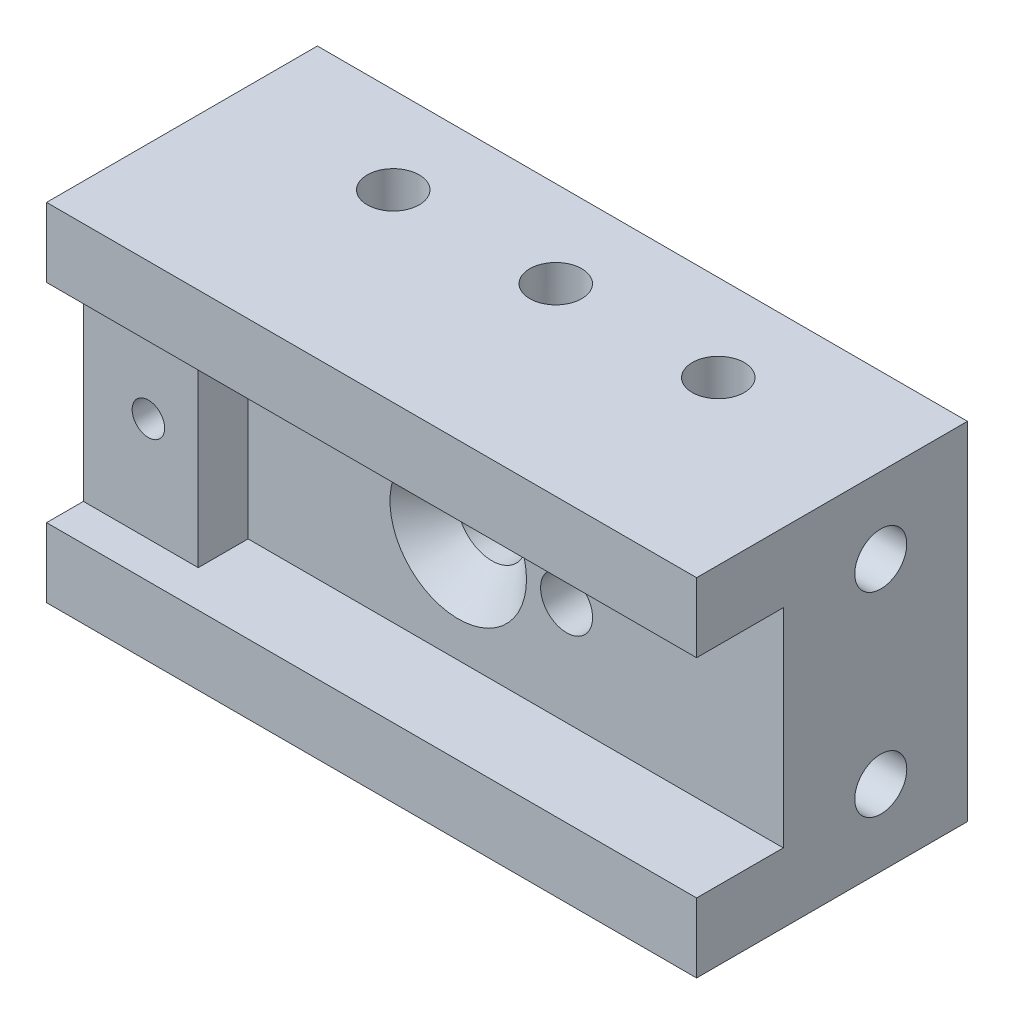
from build123d import *

# Parameters (mm, degrees)
BOSS_EXTRU_1_DEPTH                             = 15
ESQUISSE2_R                                    = 1.2
ENL_V_MAT_EXTRU_1_DEPTH                        = 26.243811123
ESQUISSE3_R                                    = 0.75
ENL_V_MAT_EXTRU_2_DEPTH                        = 20.006577809
ESQUISSE4_R                                    = 1.2
ENL_V_MAT_EXTRU_3_DEPTH                        = 34.470135942
BOSS_EXTRU_2_START                             = 2.3
ESQUISSE5_W                                    = 5.3
ESQUISSE5_H                                    = 9.6
ESQUISSE5_R                                    = 0.75
BOSS_EXTRU_2_DEPTH                             = 2.3
FRAISAGE_POUR_VIS_T_TE_FRAIS_E_M31_D           = 3.2
FRAISAGE_POUR_VIS_T_TE_FRAIS_E_M31_CSINK_D     = 6.3
FRAISAGE_POUR_VIS_T_TE_FRAIS_E_M31_CSINK_ANGLE = 90
ENL_V_MAT_EXTRU_4_DEPTH                        = 2.3
ESQUISSE9_R                                    = 1.2
ENL_V_MAT_EXTRU_5_DEPTH                        = 20.006577853


with BuildPart() as part:
    # Esquisse1 → Boss.-Extru.1 (new, symmetric)
    with BuildSketch(Plane(origin=(0, 0, 0), x_dir=(0, 0, -1), z_dir=(1, 0, 0))):
        Polygon((-12.5, -4.8), (-12.5, -8), (0, -8), (0, 8), (-12.5, 8), (-12.5, 4.8), (-8.5, 4.8), (-8.5, -4.8), align=None)
    extrude(amount=BOSS_EXTRU_1_DEPTH, both=True)

    # Esquisse2 → Enlèv. mat.-Extru.1 (cut, through all)
    with BuildSketch(Plane(origin=(0, 8, 0), x_dir=(1, 0, 0), z_dir=(0, 1, 0))):
        with Locations(Location((-7.5, -4, 0), (0, 0, 270))):
            Circle(ESQUISSE2_R)
        with Locations(Location((7.5, -4, 0), (0, 0, 90))):
            Circle(ESQUISSE2_R)
        with Locations(Location((0, -4, 0), (0, 0, 270))):
            Circle(ESQUISSE2_R)
    extrude(amount=-ENL_V_MAT_EXTRU_1_DEPTH, mode=Mode.SUBTRACT)

    # Esquisse3 → Enlèv. mat.-Extru.2 (cut, through all)
    with BuildSketch(Plane.XY.offset(8.5)):
        with Locations((-12, 0)):
            Circle(ESQUISSE3_R)
    extrude(amount=-ENL_V_MAT_EXTRU_2_DEPTH, mode=Mode.SUBTRACT)

    # Esquisse4 → Enlèv. mat.-Extru.3 (cut, through all)
    with BuildSketch(Plane(origin=(15, 0, 0), x_dir=(0, 0, -1), z_dir=(1, 0, 0))):
        with Locations((-4, -4.5)):
            Circle(ESQUISSE4_R)
        with Locations(Location((-4, 4.5, 0), (0, 0, 180))):
            Circle(ESQUISSE4_R)
    extrude(amount=-ENL_V_MAT_EXTRU_3_DEPTH, mode=Mode.SUBTRACT)

    # Esquisse5 → Boss.-Extru.2 (add)
    with BuildSketch(Plane.XY.offset(8.5).offset(BOSS_EXTRU_2_START)):
        with Locations((-12.35, 0)):
            Rectangle(ESQUISSE5_W, ESQUISSE5_H)
        with Locations((-12, 0)):
            Circle(ESQUISSE5_R, mode=Mode.SUBTRACT)
    extrude(amount=-BOSS_EXTRU_2_DEPTH)

    # Fraisage pour vis à tête fraisée M31 (through all)
    with Locations(Plane.XY.offset(8.5)):
        with Locations((0, 0)):
            CounterSinkHole(FRAISAGE_POUR_VIS_T_TE_FRAIS_E_M31_D / 2, FRAISAGE_POUR_VIS_T_TE_FRAIS_E_M31_CSINK_D / 2, counter_sink_angle=FRAISAGE_POUR_VIS_T_TE_FRAIS_E_M31_CSINK_ANGLE)

    # Esquisse8 → Enlèv. mat.-Extru.4 (cut)
    with BuildSketch(Plane(origin=(0, 0, 0), x_dir=(-1, 0, 0), z_dir=(0, 0, -1))):
        Polygon((14.8, 1.616580754), (12, 3.233161507), (9.2, 1.616580754), (9.2, -1.616580754), (12, -3.233161507), (14.8, -1.616580754), align=None)
    extrude(amount=-ENL_V_MAT_EXTRU_4_DEPTH, mode=Mode.SUBTRACT)

    # Esquisse9 → Enlèv. mat.-Extru.5 (cut, through all)
    with BuildSketch(Plane.XY.offset(8.5)):
        with Locations((5, 0)):
            Circle(ESQUISSE9_R)
    extrude(amount=-ENL_V_MAT_EXTRU_5_DEPTH, mode=Mode.SUBTRACT)


solid = part.part
